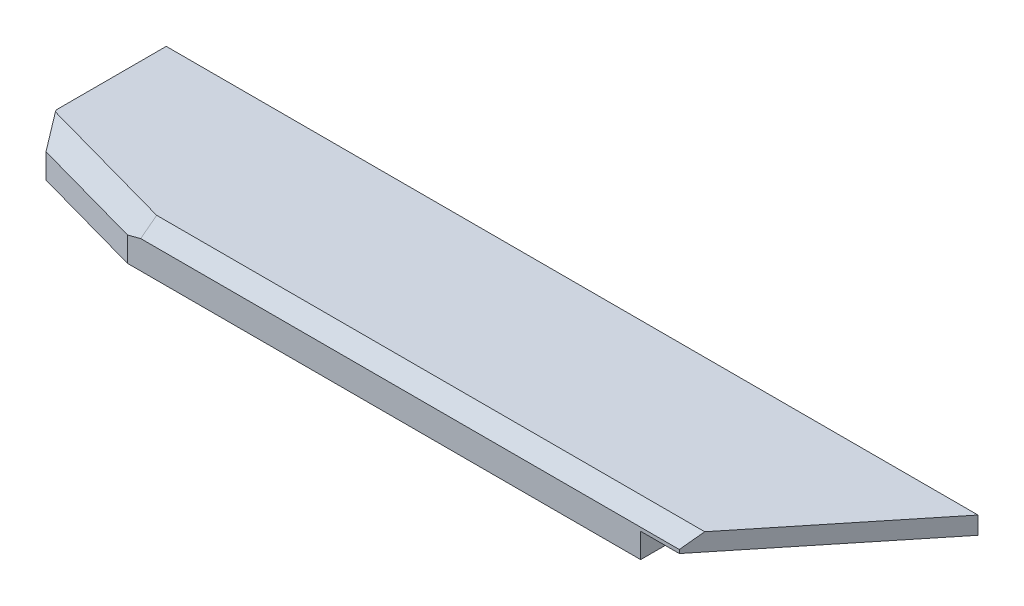
from build123d import *

# Parameters (mm, degrees)
SKETCH1_W           = 91
SKETCH1_H           = 23.5
BOSS_EXTRUDE1_DEPTH = 3.5
BOSS_EXTRUDE2_DEPTH = 2.5
CHAMFER1_SIZE       = 5
CHAMFER1_SIZE2      = 18
CHAMFER2_SIZE       = 2
CHAMFER2_SIZE2      = 2.874083337
CHAMFER3_SIZE       = 2.5
CHAMFER4_SIZE       = 2


with BuildPart() as part:
    # Sketch1 → Boss-Extrude1 (new body)
    with BuildSketch(Plane(origin=(0, 0, 0), x_dir=(1, 0, 0), z_dir=(0, 1, 0))):
        with Locations((4.795180723, 5.722891566)):
            Rectangle(SKETCH1_W, SKETCH1_H)
    extrude(amount=BOSS_EXTRUDE1_DEPTH)

    # Sketch2 → Boss-Extrude2 (add)
    with BuildSketch(Plane(origin=(0, 3.5, 0), x_dir=(1, 0, 0), z_dir=(0, 1, 0))):
        Polygon((-40.704819277, 17.472891566), (-40.704819277, -6.027108434), (55.795180723, -6.027108434), (74.795180723, 17.472891566), align=None)
    extrude(amount=BOSS_EXTRUDE2_DEPTH)

    # Chamfer1
    chamfer1_edges = [part.edges().sort_by_distance(p)[0] for p in [
        (-40.704819277, 3, 6.027108434),
    ]]
    chamfer1_side = [part.faces().sort_by_distance(p)[0] for p in [
        (-40.704819277, 3, -5.722891566),
    ]]
    chamfer(chamfer1_edges, length=CHAMFER1_SIZE, length2=CHAMFER1_SIZE2, reference=chamfer1_side[0])

    # Chamfer2
    chamfer2_edges = [part.edges().sort_by_distance(p)[0] for p in [
        (-40.704819277, 3, 1.027108434),
    ]]
    chamfer2_side = [part.faces().sort_by_distance(p)[0] for p in [
        (-31.704819277, 3, 3.527108434),
    ]]
    chamfer(chamfer2_edges, length=CHAMFER2_SIZE, length2=CHAMFER2_SIZE2, reference=chamfer2_side[0])

    # Chamfer3
    chamfer3_edges = [part.edges().sort_by_distance(p)[0] for p in [
        (-30.741301367, 6, 3.794752298),
    ]]
    chamfer(chamfer3_edges, length=CHAMFER3_SIZE)

    # Chamfer4
    chamfer4_edges = [part.edges().sort_by_distance(p)[0] for p in [
        (21.215566146, 6, 6.027108434),
    ]]
    chamfer(chamfer4_edges, length=CHAMFER4_SIZE)


solid = part.part
